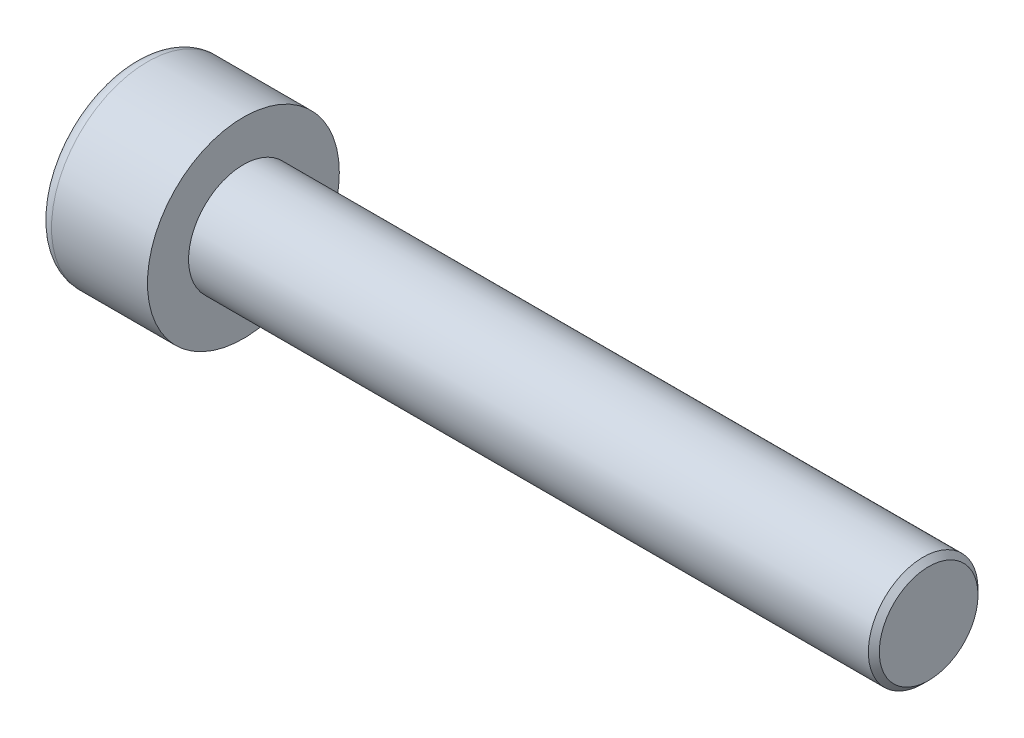
from build123d import *

# Parameters (mm, degrees)
SKETCH1_R           = 3.5
BASEHEAD_DEPTH      = 4
SKETCH2_R           = 2
BASEBODY_DEPTH      = 25
HEXAGONSOCKET_DEPTH = 2
TOPFILLET_R         = 0.5
CHAMFER1_SIZE       = 0.2


with BuildPart() as part:
    # Sketch1 → BaseHead (new body)
    with BuildSketch(Plane(origin=(0, 0, 0), x_dir=(0, 0, -1), z_dir=(1, 0, 0))):
        Circle(SKETCH1_R)
    extrude(amount=BASEHEAD_DEPTH)

    # Sketch2 → BaseBody (add)
    with BuildSketch(Plane(origin=(4, 0, 0), x_dir=(0, 0, -1), z_dir=(1, 0, 0))):
        Circle(SKETCH2_R)
    extrude(amount=BASEBODY_DEPTH)

    # Sketch3 → HexagonSocket (cut)
    with BuildSketch(Plane(origin=(0, 0, 0), x_dir=(0, 0, -1), z_dir=(1, 0, 0))):
        Polygon((1.732050808, 0), (0.866025404, 1.5), (-0.866025404, 1.5), (-1.732050808, 0), (-0.866025404, -1.5), (0.866025404, -1.5), align=None)
    extrude(amount=HEXAGONSOCKET_DEPTH, mode=Mode.SUBTRACT)

    # Sketch4 → Cut-Revolve1 (revolve, cut)
    with BuildSketch(Plane(origin=(-4.19613823, 0.75, 0), x_dir=(-1, 0, 0), z_dir=(0, 0, 1)), mode=Mode.PRIVATE) as cut_revolve1_sk:
        Polygon((-6.19613823, 2.25), (-7.062163633, 0.75), (-6.19613823, 0.75), align=None)
    revolve(cut_revolve1_sk.sketch.rotate(Axis((0.838992387, 0, 0), (-1, 0, 0)), 90), axis=Axis((0.838992387, 0, 0), (-1, 0, 0)), mode=Mode.SUBTRACT)

    # TopFillet
    topfillet_edges = [part.edges().sort_by_distance(p)[0] for p in [
        (0, 0, 3.5),
    ]]
    fillet(topfillet_edges, radius=TOPFILLET_R)

    # Chamfer1
    chamfer1_edges = [part.edges().sort_by_distance(p)[0] for p in [
        (29, 0, 2),
    ]]
    chamfer(chamfer1_edges, length=CHAMFER1_SIZE)


solid = part.part
